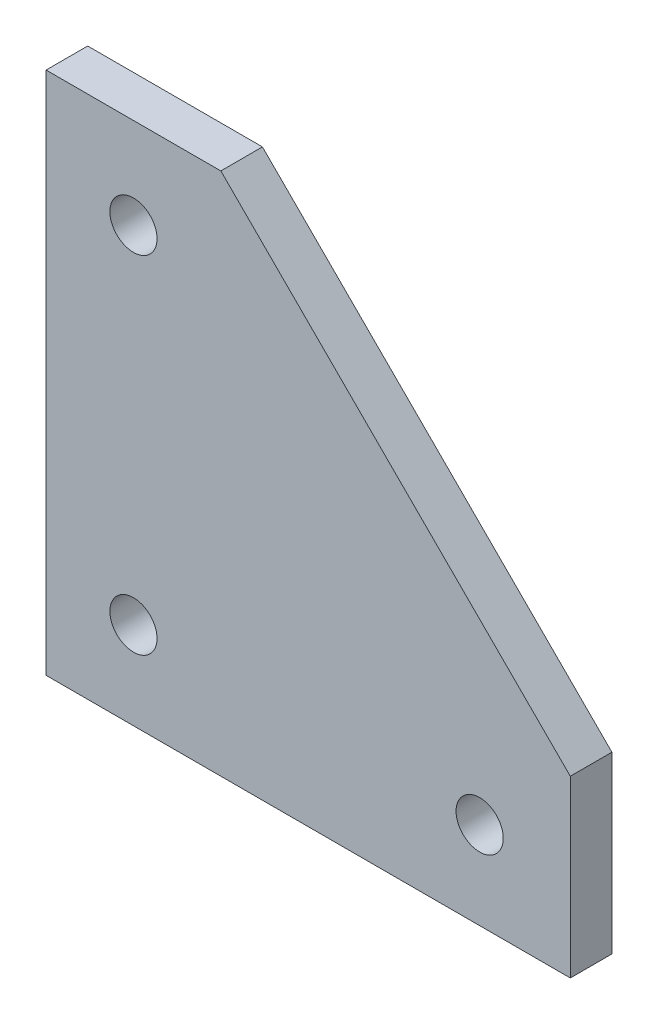
from build123d import *

# Parameters (mm, degrees)
SKETCH1_R           = 2.7
BOSS_EXTRUDE1_DEPTH = 2.38125


with BuildPart() as part:
    # Sketch1 → Boss-Extrude1 (new, symmetric)
    with BuildSketch(Plane.XY):
        Polygon((0, 0), (0, 60), (20, 60), (60, 20), (60, 0), align=None)
        with Locations(Location((10, 10, 0), (0, 0, 180))):
            Circle(SKETCH1_R, mode=Mode.SUBTRACT)
        with Locations(Location((49.624, 10, 0), (0, 0, 180))):
            Circle(SKETCH1_R, mode=Mode.SUBTRACT)
        with Locations(Location((10, 49.624, 0), (0, 0, 180))):
            Circle(SKETCH1_R, mode=Mode.SUBTRACT)
    extrude(amount=BOSS_EXTRUDE1_DEPTH, both=True)


solid = part.part
